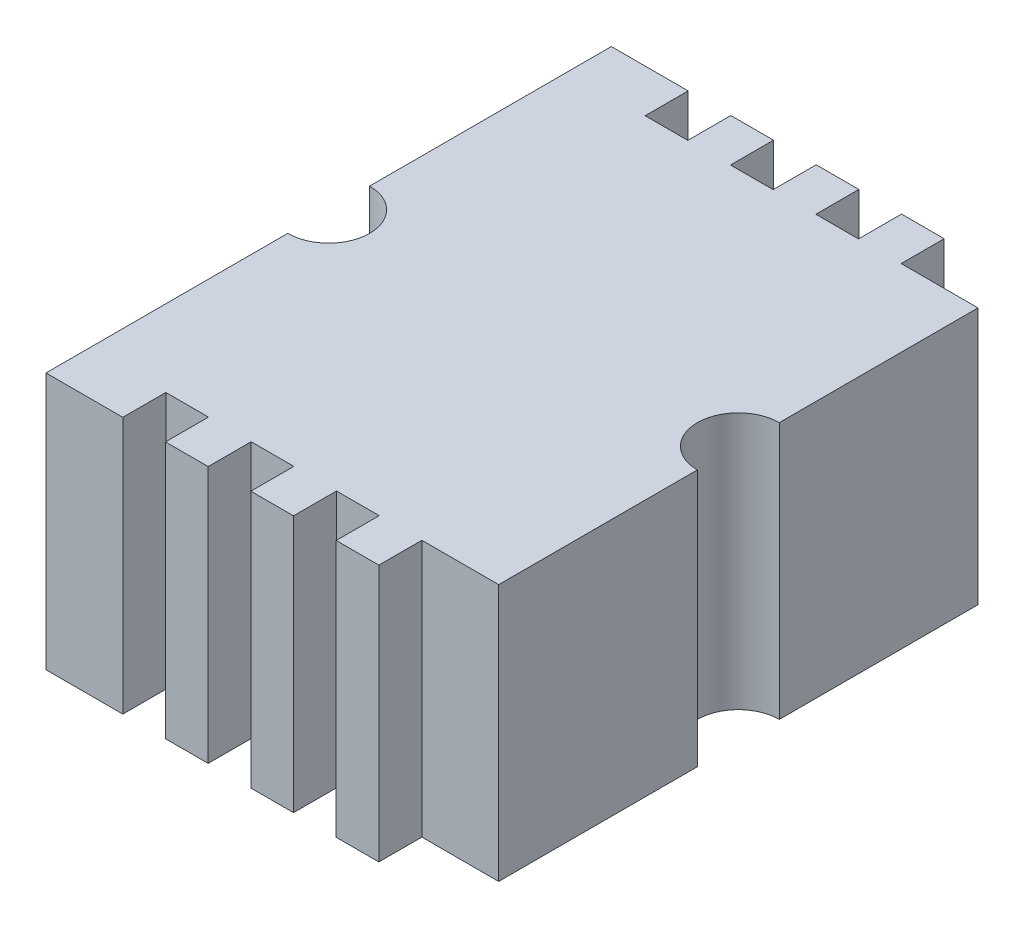
from build123d import *

# Parameters (mm, degrees)
SKETCH1_W           = 40
SKETCH1_H           = 29.4
SKETCH1_R           = 2
BOSS_EXTRUDE1_DEPTH = 20
SKETCH2_W           = 20
SKETCH2_H           = 12.55
CUT_EXTRUDE1_DEPTH  = 3
CUT_EXTRUDE2_REACH  = 42.797
SKETCH2_3_W         = 10
SKETCH2_3_H         = 20
BOSS_EXTRUDE2_REACH = 28.76
SKETCH4_W           = 2.083333333
SKETCH4_H           = 2.1
SKETCH4_W_2         = 2.083333334
SKETCH4_W_3         = 3.75
SKETCH5_W           = 20
SKETCH5_H           = 29.4
CUT_EXTRUDE3_DEPTH  = 7.45


with BuildPart() as part:
    # Sketch1 → Boss-Extrude1 (new body)
    with BuildSketch(Plane(origin=(0, 0, 0), x_dir=(1, 0, 0), z_dir=(0, 1, 0))):
        Rectangle(SKETCH1_W, SKETCH1_H)
        with Locations(Location((-10, 0, 0), (0, 0, 270))):
            Circle(SKETCH1_R, mode=Mode.SUBTRACT)
        with Locations(Location((10, 0, 0), (0, 0, 270))):
            Circle(SKETCH1_R, mode=Mode.SUBTRACT)
    extrude(amount=BOSS_EXTRUDE1_DEPTH)

    # Sketch2 → Cut-Extrude1 (cut)
    with BuildSketch(Plane(origin=(0, 0, -14.7), x_dir=(-1, 0, 0), z_dir=(0, 0, -1))):
        with Locations((0, 13.725)):
            Rectangle(SKETCH2_W, SKETCH2_H)
    cut_extrude1 = extrude(amount=-CUT_EXTRUDE1_DEPTH, mode=Mode.SUBTRACT)

    # Mirror1: Cut-Extrude1 across plane
    add(cut_extrude1.mirror(Plane.XY), mode=Mode.SUBTRACT)

    # Sketch2<3> → Cut-Extrude2 (cut, up to next)
    with BuildSketch(Plane(origin=(0, 0, -14.7), x_dir=(-1, 0, 0), z_dir=(0, 0, -1)), mode=Mode.PRIVATE) as cut_extrude2_sk1:
        with Locations((-15, 10)):
            Rectangle(SKETCH2_3_W, SKETCH2_3_H)
    cut_extrude2_tool1 = extrude(cut_extrude2_sk1.sketch, amount=-CUT_EXTRUDE2_REACH, mode=Mode.PRIVATE) & part.part
    # Sketch2<3> → Cut-Extrude2 (cut, up to next)
    with BuildSketch(Plane(origin=(0, 0, -14.7), x_dir=(-1, 0, 0), z_dir=(0, 0, -1)), mode=Mode.PRIVATE) as cut_extrude2_sk2:
        with Locations((15, 10)):
            Rectangle(SKETCH2_3_W, SKETCH2_3_H)
    cut_extrude2_tool2 = extrude(cut_extrude2_sk2.sketch, amount=-CUT_EXTRUDE2_REACH, mode=Mode.PRIVATE) & part.part
    add(cut_extrude2_tool1.solids().sort_by_distance((15, 10, -14.7))[0], mode=Mode.SUBTRACT)
    add(cut_extrude2_tool2.solids().sort_by_distance((-15, 10, -14.7))[0], mode=Mode.SUBTRACT)

    # Sketch4 → Boss-Extrude2 (add, up to next)
    with BuildSketch(Plane(origin=(0, 20, 0), x_dir=(1, 0, 0), z_dir=(0, 1, 0)), mode=Mode.PRIVATE) as boss_extrude2_sk1:
        with Locations((5.208333334, 12.75)):
            Rectangle(SKETCH4_W, SKETCH4_H)
    boss_extrude2_tool1 = extrude(boss_extrude2_sk1.sketch, amount=-BOSS_EXTRUDE2_REACH, mode=Mode.PRIVATE) - part.part
    # Sketch4 → Boss-Extrude2 (add, up to next)
    with BuildSketch(Plane(origin=(0, 20, 0), x_dir=(1, 0, 0), z_dir=(0, 1, 0)), mode=Mode.PRIVATE) as boss_extrude2_sk2:
        with Locations((1.041666667, 12.75)):
            Rectangle(SKETCH4_W, SKETCH4_H)
    boss_extrude2_tool2 = extrude(boss_extrude2_sk2.sketch, amount=-BOSS_EXTRUDE2_REACH, mode=Mode.PRIVATE) - part.part
    # Sketch4 → Boss-Extrude2 (add, up to next)
    with BuildSketch(Plane(origin=(0, 20, 0), x_dir=(1, 0, 0), z_dir=(0, 1, 0)), mode=Mode.PRIVATE) as boss_extrude2_sk3:
        with Locations((-3.125, 12.75)):
            Rectangle(SKETCH4_W_2, SKETCH4_H)
    boss_extrude2_tool3 = extrude(boss_extrude2_sk3.sketch, amount=-BOSS_EXTRUDE2_REACH, mode=Mode.PRIVATE) - part.part
    # Sketch4 → Boss-Extrude2 (add, up to next)
    with BuildSketch(Plane(origin=(0, 20, 0), x_dir=(1, 0, 0), z_dir=(0, 1, 0)), mode=Mode.PRIVATE) as boss_extrude2_sk4:
        with Locations((-8.125, 12.75)):
            Rectangle(SKETCH4_W_3, SKETCH4_H)
    boss_extrude2_tool4 = extrude(boss_extrude2_sk4.sketch, amount=-BOSS_EXTRUDE2_REACH, mode=Mode.PRIVATE) - part.part
    boss_extrude2_1 = boss_extrude2_tool1.solids().sort_by_distance((5.208333, 20, -12.75))[0]
    add(boss_extrude2_1)
    boss_extrude2_2 = boss_extrude2_tool2.solids().sort_by_distance((1.041667, 20, -12.75))[0]
    add(boss_extrude2_2)
    boss_extrude2_3 = boss_extrude2_tool3.solids().sort_by_distance((-3.125, 20, -12.75))[0]
    add(boss_extrude2_3)
    boss_extrude2_4 = boss_extrude2_tool4.solids().sort_by_distance((-8.125, 20, -12.75))[0]
    add(boss_extrude2_4)
    boss_extrude2 = boss_extrude2_1 + boss_extrude2_2 + boss_extrude2_3 + boss_extrude2_4  # Boss-Extrude2 as one shape, for the pattern or mirror that repeats it

    # Mirror2: Boss-Extrude2 across plane
    add(boss_extrude2.mirror(Plane.XY))

    # Sketch5 → Cut-Extrude3 (cut)
    with BuildSketch(Plane.XZ):
        Rectangle(SKETCH5_W, SKETCH5_H)
    extrude(amount=-CUT_EXTRUDE3_DEPTH, mode=Mode.SUBTRACT)


solid = part.part
